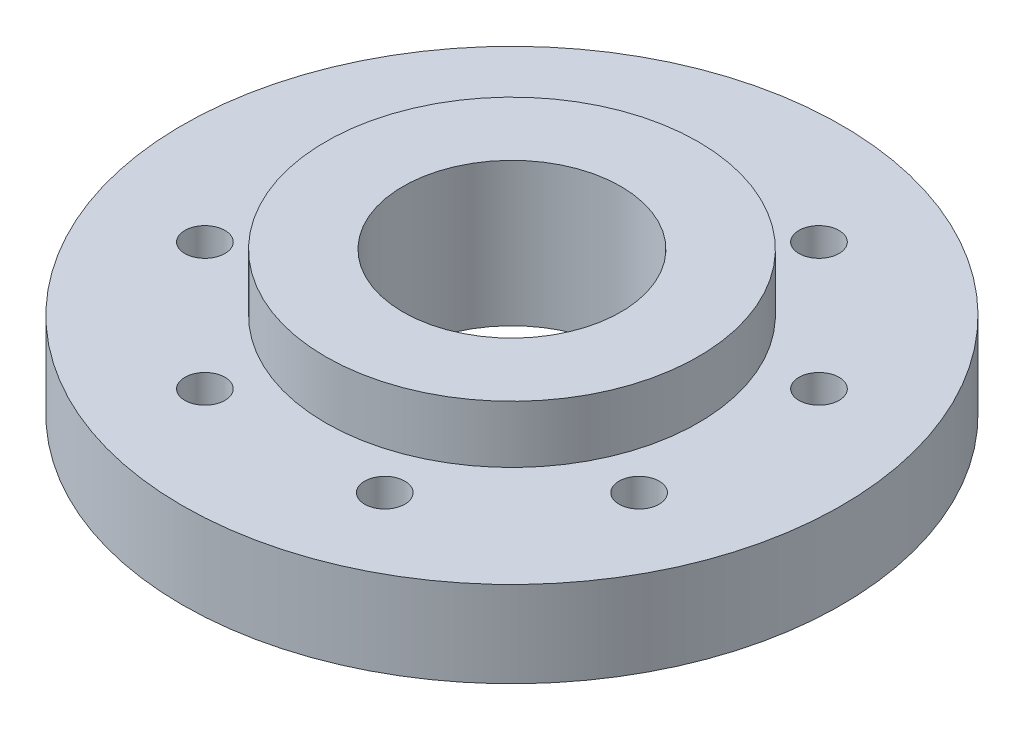
from build123d import *

# Parameters (mm, degrees)
F_01_FLANGE_PROFILE_R     = 115
F_01_FLANGE_PROFILE_R_2   = 38
F_01_FLANGE_PROFILE_R_3   = 7
F_01_FLANGE_EXTRUDE_DEPTH = 30
F_02_HUB_PROFILE_R        = 65
F_02_HUB_PROFILE_R_2      = 38
F_02_LOCATING_HUB_DEPTH   = 50


with BuildPart() as part:
    # 01_Flange_Profile → 01_Flange_Extrude (new body)
    with BuildSketch(Plane(origin=(0, 0, 0), x_dir=(1, 0, 0), z_dir=(0, 1, 0))):
        with Locations(Location((0, 0, 0), (0, 0, 270))):
            Circle(F_01_FLANGE_PROFILE_R)
        with Locations(Location((0, 0, 0), (0, 0, 270))):
            Circle(F_01_FLANGE_PROFILE_R_2, mode=Mode.SUBTRACT)
        with Locations(Location((75.758121666, 31.380041454, 0), (0, 0, 270))):
            Circle(F_01_FLANGE_PROFILE_R_3, mode=Mode.SUBTRACT)
        with Locations(Location((31.380041454, 75.758121666, 0), (0, 0, 270))):
            Circle(F_01_FLANGE_PROFILE_R_3, mode=Mode.SUBTRACT)
        with Locations(Location((-31.380041454, 75.758121666, 0), (0, 0, 270))):
            Circle(F_01_FLANGE_PROFILE_R_3, mode=Mode.SUBTRACT)
        with Locations(Location((-75.758121666, 31.380041454, 0), (0, 0, 270))):
            Circle(F_01_FLANGE_PROFILE_R_3, mode=Mode.SUBTRACT)
        with Locations(Location((-75.758121666, -31.380041454, 0), (0, 0, 270))):
            Circle(F_01_FLANGE_PROFILE_R_3, mode=Mode.SUBTRACT)
        with Locations(Location((-31.380041454, -75.758121666, 0), (0, 0, 270))):
            Circle(F_01_FLANGE_PROFILE_R_3, mode=Mode.SUBTRACT)
        with Locations(Location((31.380041454, -75.758121666, 0), (0, 0, 270))):
            Circle(F_01_FLANGE_PROFILE_R_3, mode=Mode.SUBTRACT)
        with Locations(Location((75.758121666, -31.380041454, 0), (0, 0, 270))):
            Circle(F_01_FLANGE_PROFILE_R_3, mode=Mode.SUBTRACT)
    extrude(amount=F_01_FLANGE_EXTRUDE_DEPTH)

    # 02_Hub_Profile → 02_Locating_Hub (add)
    with BuildSketch(Plane(origin=(0, 0, 0), x_dir=(1, 0, 0), z_dir=(0, 1, 0))):
        with Locations(Location((0, 0, 0), (0, 0, 270))):
            Circle(F_02_HUB_PROFILE_R)
        with Locations(Location((0, 0, 0), (0, 0, 270))):
            Circle(F_02_HUB_PROFILE_R_2, mode=Mode.SUBTRACT)
    extrude(amount=F_02_LOCATING_HUB_DEPTH)


solid = part.part
